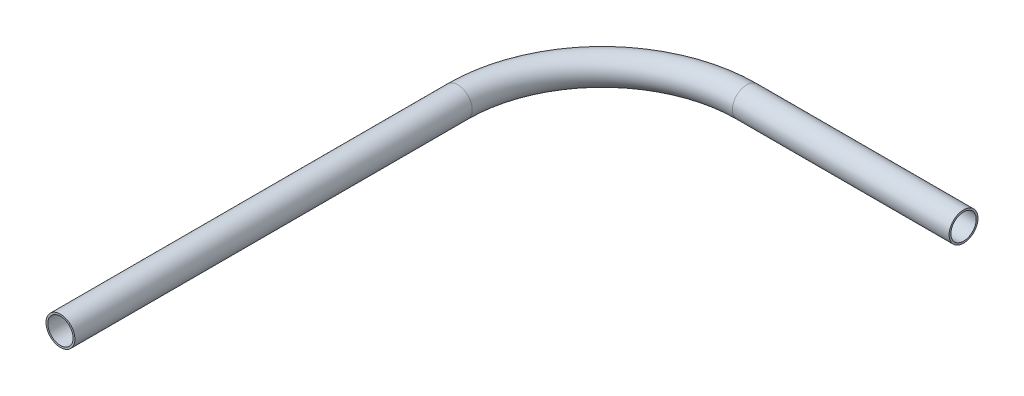
from build123d import *

# Parameters (mm, degrees)
SKETCH_2_R   = 8
SKETCH_2_R_2 = 7


with BuildPart() as part:
    # По траектории1: sweep along a path in Эскиз1
    with BuildLine(Plane(origin=(0, 0, 0), x_dir=(1, 0, 0), z_dir=(0, 1, 0))) as sweep_1_path:
        Line((-200, -300), (-200, -80))
        ThreePointArc((-200, -80), (-176.568542495, -23.431457505), (-120, 0))
        Line((-120, 0), (0, 0))
    # Эскиз2 → По траектории1 (sweep)
    with BuildSketch(Plane(origin=(0, 0, 0), x_dir=(0, 0, -1), z_dir=(1, 0, 0))):
        Circle(SKETCH_2_R)
        Circle(SKETCH_2_R_2, mode=Mode.SUBTRACT)
    sweep(path=sweep_1_path.line)


solid = part.part
